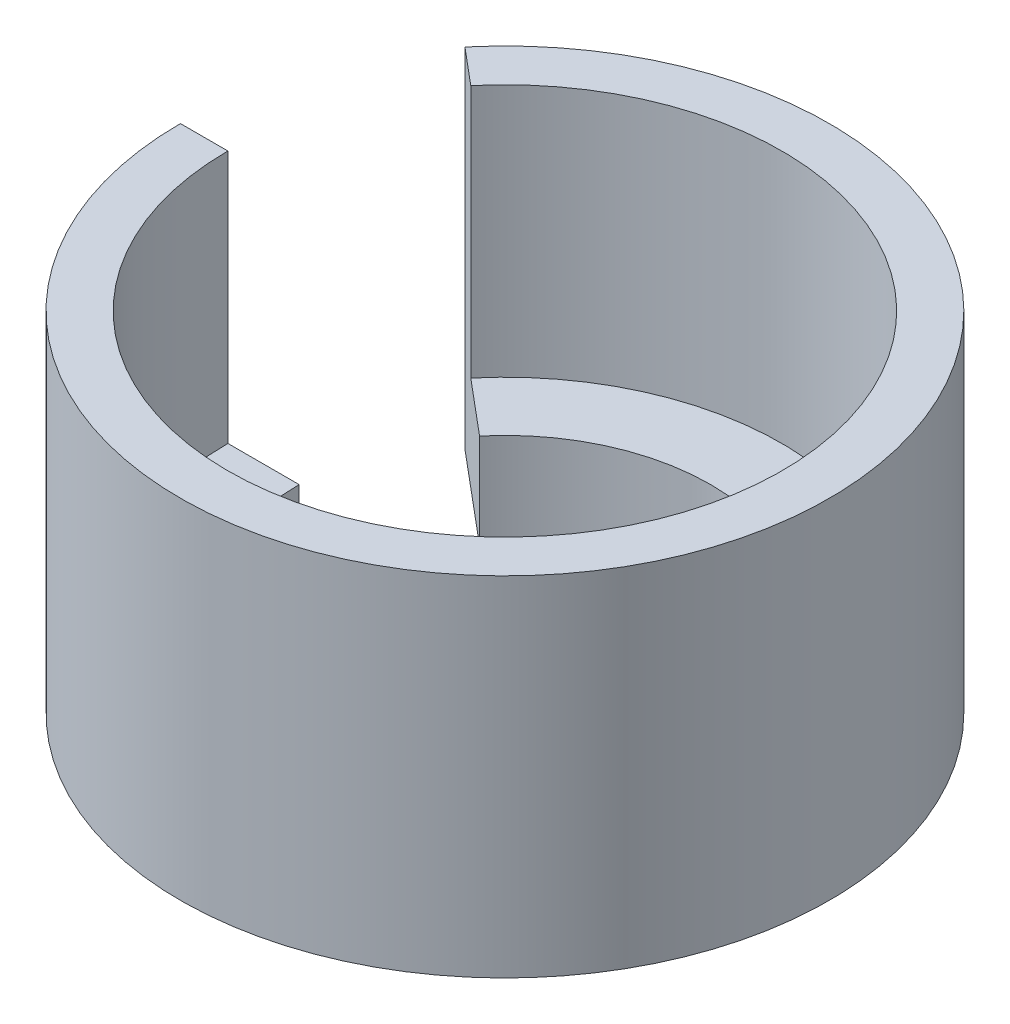
from build123d import *

# Parameters (mm, degrees)
REVOLVE1_ANGLE = 320


with BuildPart() as part:
    # Sketch1 → Revolve1 (revolve)
    with BuildSketch(Plane.XY):
        Polygon((-3.5, 1.2), (-3.5, 4.4), (-4.1, 4.4), (-4.1, 0), (-2.6, 0), (-2.6, 1.2), align=None)
    revolve(axis=Axis((0, 0, 0), (0, 1, 0)), revolution_arc=REVOLVE1_ANGLE)


solid = part.part
